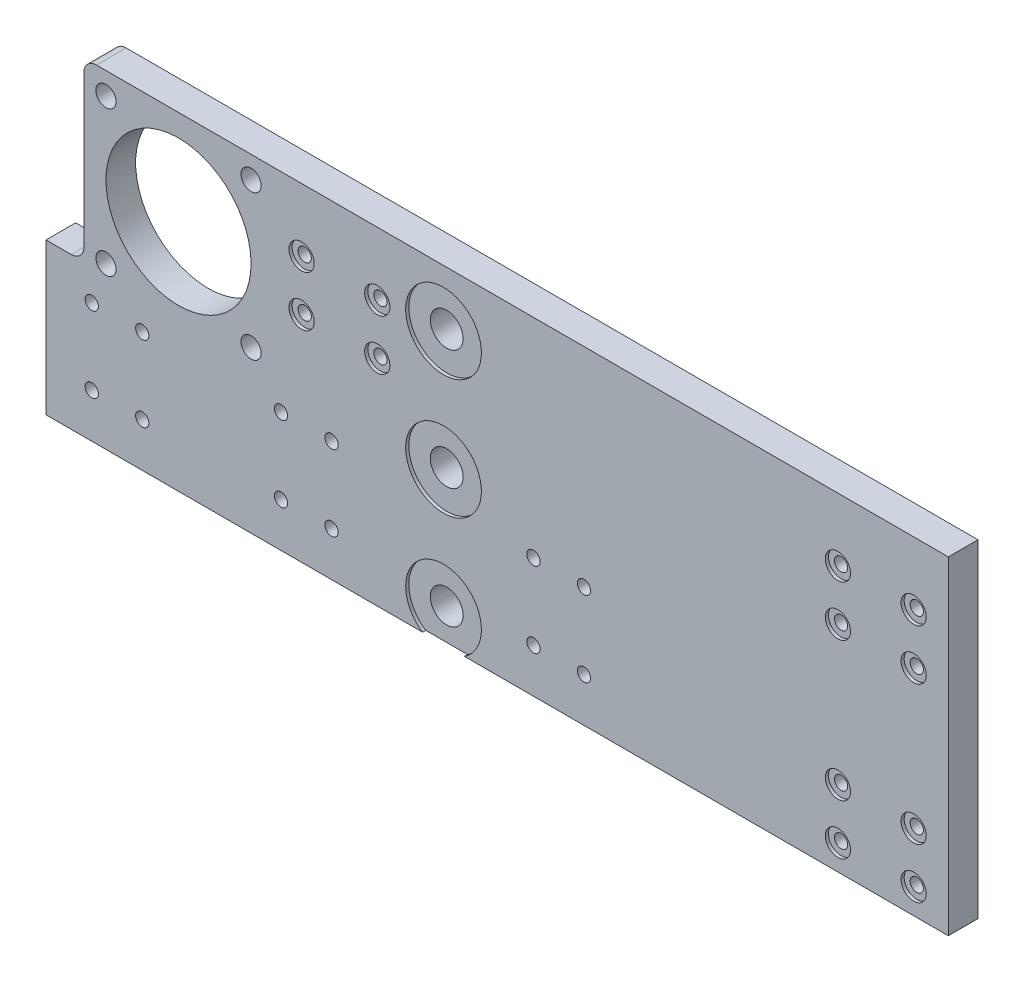
from build123d import *

# Parameters (mm, degrees)
SKETCH_1_R          = 11.5
SKETCH_1_R_2        = 1.6
SKETCH_1_R_3        = 1.05
SKETCH_1_R_4        = 2.6
EXTRUDE_1_DEPTH     = 4.7
SKETCH_2_R          = 2
SKETCH_2_R_2        = 6
CUT_EXTRUDE_1_DEPTH = 0.5
SKETCH_5_R          = 2
CUT_EXTRUDE_2_DEPTH = 2
FILLET_1_R          = 2


with BuildPart() as part:
    # 草图1 → 凸台-拉伸1 (new body)
    with BuildSketch(Plane.XY):
        Polygon((0, 0), (135, 0), (135, -52), (0, -52), (-8, -52), (-8, -28), (-2, -28), (-2, 0), align=None)
        with Locations((13, -15)):
            Circle(SKETCH_1_R, mode=Mode.SUBTRACT)
        with Locations((1.5, -3.5)):
            Circle(SKETCH_1_R_2, mode=Mode.SUBTRACT)
        with Locations((24.5, -3.5)):
            Circle(SKETCH_1_R_2, mode=Mode.SUBTRACT)
        with Locations((1.5, -26.5)):
            Circle(SKETCH_1_R_2, mode=Mode.SUBTRACT)
        with Locations((24.5, -26.5)):
            Circle(SKETCH_1_R_2, mode=Mode.SUBTRACT)
        with Locations((32.5, -10)):
            Circle(SKETCH_1_R_3, mode=Mode.SUBTRACT)
        with Locations((44.5, -10)):
            Circle(SKETCH_1_R_3, mode=Mode.SUBTRACT)
        with Locations((32.5, -18)):
            Circle(SKETCH_1_R_3, mode=Mode.SUBTRACT)
        with Locations((44.5, -18)):
            Circle(SKETCH_1_R_3, mode=Mode.SUBTRACT)
        with Locations((117.5, -10)):
            Circle(SKETCH_1_R_3, mode=Mode.SUBTRACT)
        with Locations((129.5, -10)):
            Circle(SKETCH_1_R_3, mode=Mode.SUBTRACT)
        with Locations((117.5, -18)):
            Circle(SKETCH_1_R_3, mode=Mode.SUBTRACT)
        with Locations((129.5, -18)):
            Circle(SKETCH_1_R_3, mode=Mode.SUBTRACT)
        with Locations((-0.75, -33)):
            Circle(SKETCH_1_R_3, mode=Mode.SUBTRACT)
        with Locations((7.25, -33)):
            Circle(SKETCH_1_R_3, mode=Mode.SUBTRACT)
        with Locations((-0.75, -45)):
            Circle(SKETCH_1_R_3, mode=Mode.SUBTRACT)
        with Locations((7.25, -45)):
            Circle(SKETCH_1_R_3, mode=Mode.SUBTRACT)
        with Locations((29.25, -33)):
            Circle(SKETCH_1_R_3, mode=Mode.SUBTRACT)
        with Locations((37.25, -33)):
            Circle(SKETCH_1_R_3, mode=Mode.SUBTRACT)
        with Locations((37.25, -45)):
            Circle(SKETCH_1_R_3, mode=Mode.SUBTRACT)
        with Locations((29.25, -45)):
            Circle(SKETCH_1_R_3, mode=Mode.SUBTRACT)
        with Locations((117.5, -40)):
            Circle(SKETCH_1_R_3, mode=Mode.SUBTRACT)
        with Locations((129.5, -40)):
            Circle(SKETCH_1_R_3, mode=Mode.SUBTRACT)
        with Locations((117.5, -48)):
            Circle(SKETCH_1_R_3, mode=Mode.SUBTRACT)
        with Locations((129.5, -48)):
            Circle(SKETCH_1_R_3, mode=Mode.SUBTRACT)
        with Locations((55, -28)):
            Circle(SKETCH_1_R_4, mode=Mode.SUBTRACT)
        with Locations((55, -47)):
            Circle(SKETCH_1_R_4, mode=Mode.SUBTRACT)
        with Locations((77.25, -33)):
            Circle(SKETCH_1_R_3, mode=Mode.SUBTRACT)
        with Locations((77.25, -45)):
            Circle(SKETCH_1_R_3, mode=Mode.SUBTRACT)
        with Locations((69.25, -45)):
            Circle(SKETCH_1_R_3, mode=Mode.SUBTRACT)
        with Locations((69.25, -33)):
            Circle(SKETCH_1_R_3, mode=Mode.SUBTRACT)
        with Locations((55, -9)):
            Circle(SKETCH_1_R_4, mode=Mode.SUBTRACT)
    extrude(amount=EXTRUDE_1_DEPTH)

    # 草图2 → 切除-拉伸1 (cut)
    with BuildSketch(Plane.XY.offset(4.7)):
        with Locations((32.5, -10)):
            Circle(SKETCH_2_R)
        with Locations((44.5, -10)):
            Circle(SKETCH_2_R)
        with Locations((32.5, -18)):
            Circle(SKETCH_2_R)
        with Locations((44.5, -18)):
            Circle(SKETCH_2_R)
        with Locations((117.5, -10)):
            Circle(SKETCH_2_R)
        with Locations((129.5, -10)):
            Circle(SKETCH_2_R)
        with Locations((117.5, -18)):
            Circle(SKETCH_2_R)
        with Locations((129.5, -18)):
            Circle(SKETCH_2_R)
        with Locations((117.5, -40)):
            Circle(SKETCH_2_R)
        with Locations((129.5, -40)):
            Circle(SKETCH_2_R)
        with Locations((117.5, -48)):
            Circle(SKETCH_2_R)
        with Locations((55, -28)):
            Circle(SKETCH_2_R_2)
        with Locations((129.5, -48)):
            Circle(SKETCH_2_R)
        with Locations((55, -47)):
            Circle(SKETCH_2_R_2)
        with Locations((55, -9)):
            Circle(SKETCH_2_R_2)
    extrude(amount=-CUT_EXTRUDE_1_DEPTH, mode=Mode.SUBTRACT)

    # 草图5 → 切除-拉伸2 (cut)
    with BuildSketch(Plane(origin=(0, 0, 0), x_dir=(-1, 0, 0), z_dir=(0, 0, -1))):
        with Locations((-37.25, -33)):
            Circle(SKETCH_5_R)
        with Locations((-29.25, -33)):
            Circle(SKETCH_5_R)
        with Locations((-37.25, -45)):
            Circle(SKETCH_5_R)
        with Locations((-29.25, -45)):
            Circle(SKETCH_5_R)
        with Locations((-7.25, -33)):
            Circle(SKETCH_5_R)
        with Locations((0.75, -33)):
            Circle(SKETCH_5_R)
        with Locations((-7.25, -45)):
            Circle(SKETCH_5_R)
        with Locations((0.75, -45)):
            Circle(SKETCH_5_R)
        with Locations((-69.25, -33)):
            Circle(SKETCH_5_R)
        with Locations((-69.25, -45)):
            Circle(SKETCH_5_R)
        with Locations((-77.25, -45)):
            Circle(SKETCH_5_R)
        with Locations((-77.25, -33)):
            Circle(SKETCH_5_R)
    extrude(amount=-CUT_EXTRUDE_2_DEPTH, mode=Mode.SUBTRACT)

    # 圆角1
    fillet_1_edges = [part.edges().sort_by_distance(p)[0] for p in [
        (-2, -28, 2.35),
        (-2, 0, 2.35),
    ]]
    fillet(fillet_1_edges, radius=FILLET_1_R)


solid = part.part
